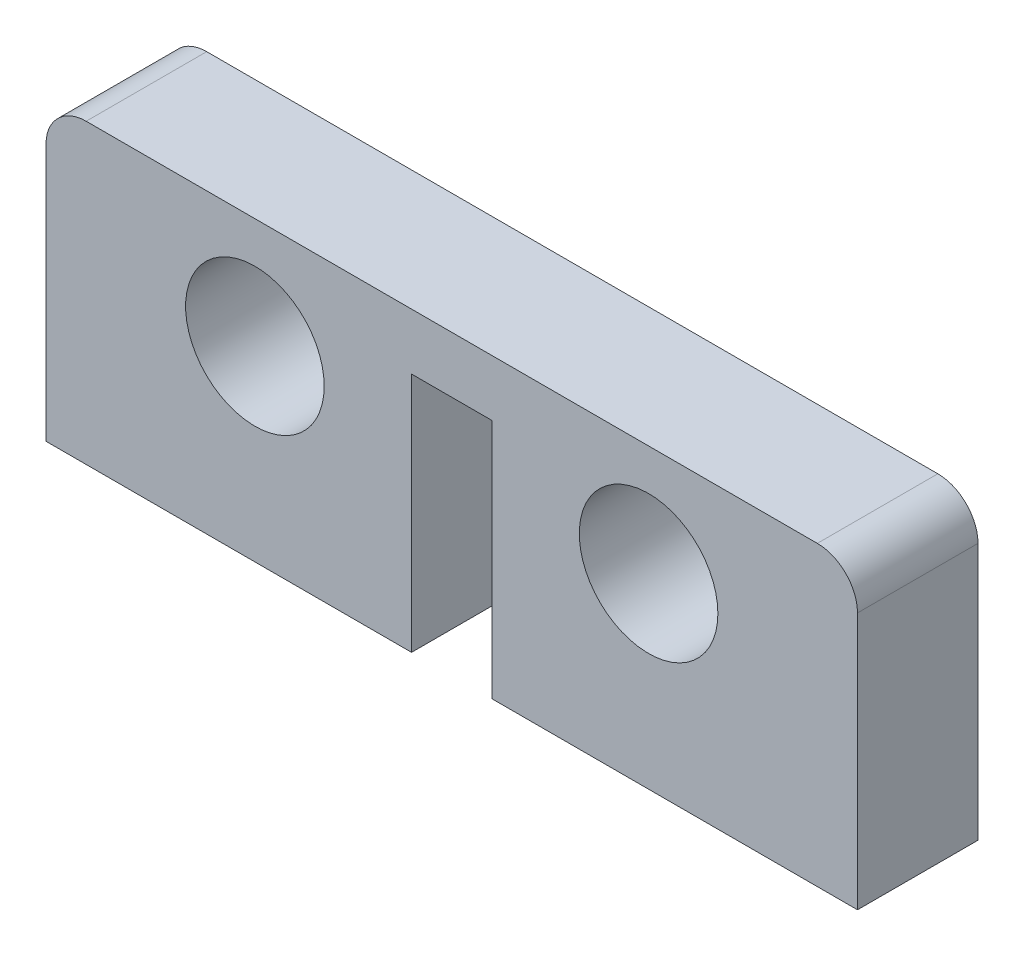
from build123d import *

# Parameters (mm, degrees)
SKETCH1_W           = 20.2
SKETCH1_H           = 7.4
SKETCH1_R           = 1.725
BOSS_EXTRUDE1_DEPTH = 3
SKETCH2_W           = 2
SKETCH2_H           = 6
CUT_EXTRUDE1_DEPTH  = 3
FILLET1_R           = 1


with BuildPart() as part:
    # Sketch1 → Boss-Extrude1 (new body)
    with BuildSketch(Plane.XY):
        Rectangle(SKETCH1_W, SKETCH1_H)
        with Locations((-4.9, 0.95)):
            Circle(SKETCH1_R, mode=Mode.SUBTRACT)
        with Locations((4.9, 0.95)):
            Circle(SKETCH1_R, mode=Mode.SUBTRACT)
    extrude(amount=BOSS_EXTRUDE1_DEPTH)

    # Sketch2 → Cut-Extrude1 (cut)
    with BuildSketch(Plane.XY.offset(3)):
        with Locations((0, -0.7)):
            Rectangle(SKETCH2_W, SKETCH2_H)
    extrude(amount=-CUT_EXTRUDE1_DEPTH, mode=Mode.SUBTRACT)

    # Fillet1
    fillet1_edges = [part.edges().sort_by_distance(p)[0] for p in [
        (10.1, 3.7, 1.5),
        (-10.1, 3.7, 1.5),
    ]]
    fillet(fillet1_edges, radius=FILLET1_R)


solid = part.part
